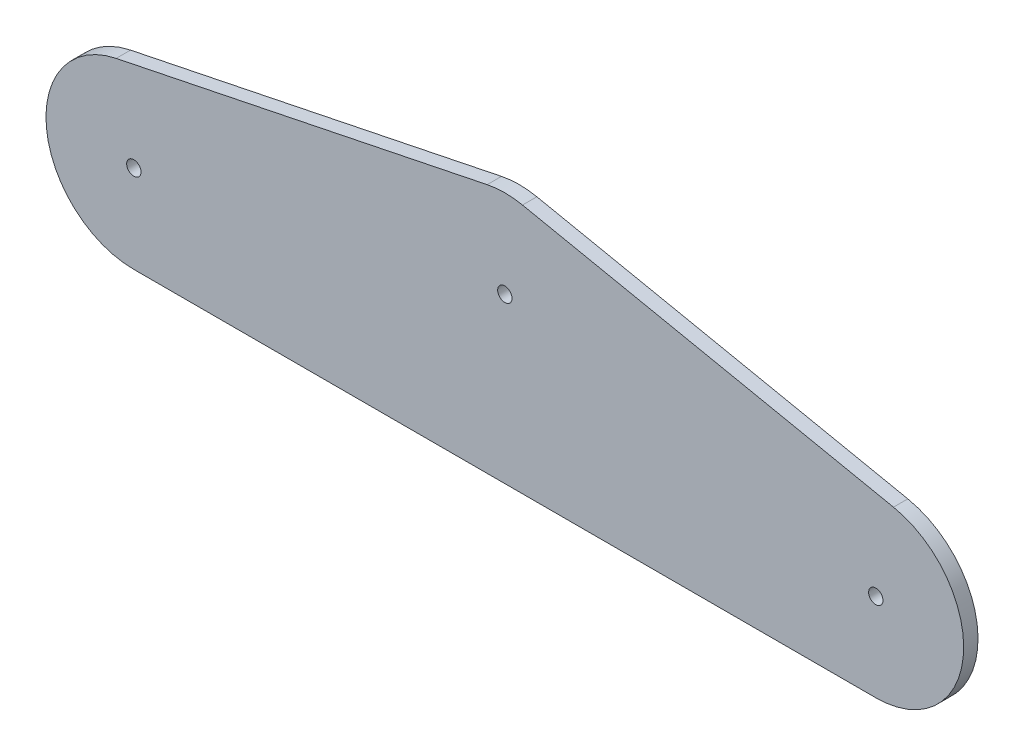
from build123d import *

# Parameters (mm, degrees)
SKETCH1_R           = 3.1115
BOSS_EXTRUDE1_DEPTH = 6.223


with BuildPart() as part:
    # Sketch1 → Boss-Extrude1 (new body)
    with BuildSketch(Plane.XY):
        with BuildLine():
            ThreePointArc((-168.527471794, 37.321871132), (-198.771635273, -3.850111029), (-160.866666667, -38.1))
            Line((-160.866666667, -38.1), (160.866666667, -38.1))
            ThreePointArc((160.866666667, -38.1), (198.771635273, -3.850111029), (168.527471794, 37.321871132))
            Line((168.527471794, 37.321871132), (7.660805127, 70.341871132))
            ThreePointArc((7.660805127, 70.341871132), (0, 71.12), (-7.660805127, 70.341871132))
            Line((-7.660805127, 70.341871132), (-168.527471794, 37.321871132))
        make_face()
        with Locations((-160.866666667, 0)):
            Circle(SKETCH1_R, mode=Mode.SUBTRACT)
        with Locations((160.866666667, 0)):
            Circle(SKETCH1_R, mode=Mode.SUBTRACT)
        with Locations((0, 33.02)):
            Circle(SKETCH1_R, mode=Mode.SUBTRACT)
    extrude(amount=BOSS_EXTRUDE1_DEPTH)


solid = part.part
